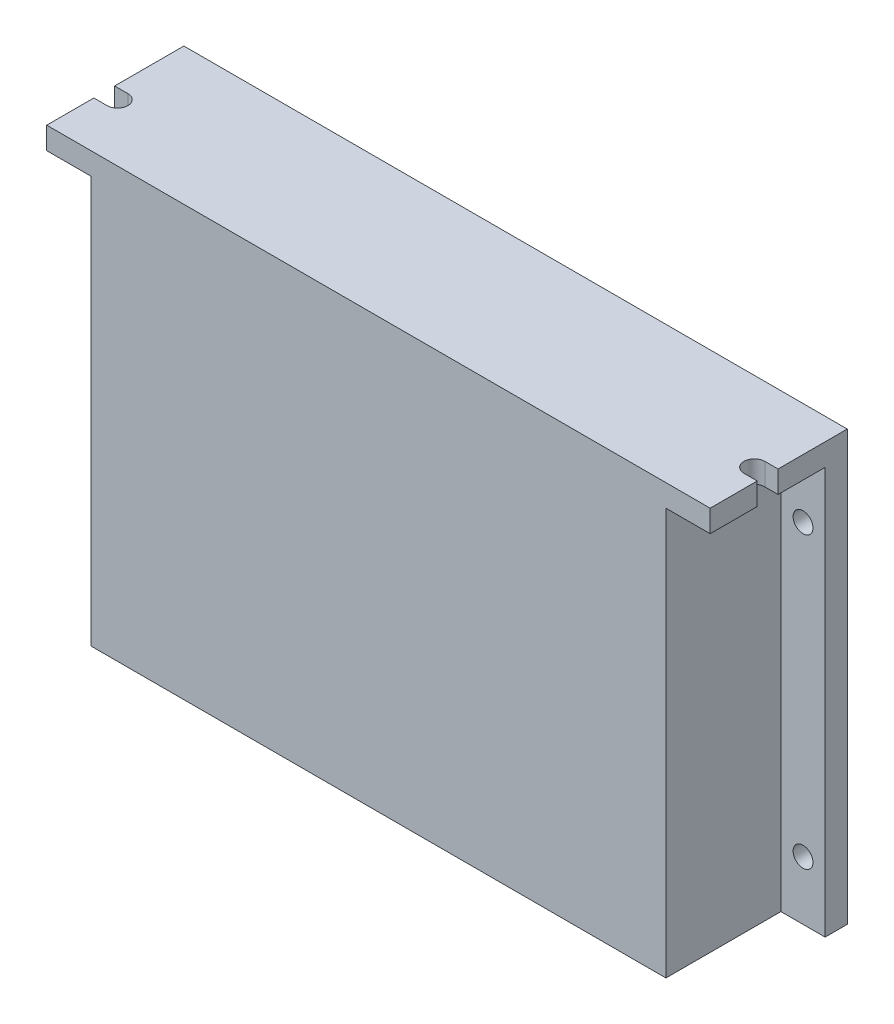
from build123d import *

# Parameters (mm, degrees)
SKETCH_1_W          = 150
SKETCH_1_H          = 31
EXTRUDE_1_DEPTH     = 97
SKETCH_2_R          = 2.25
CUT_EXTRUDE_1_DEPTH = 127.471340627
SKETCH_3_W          = 10
SKETCH_3_H          = 92
CUT_EXTRUDE_2_DEPTH = 26
CUT_EXTRUDE_3_DEPTH = 5


with BuildPart() as part:
    # 草图1 → 凸台-拉伸1 (new body)
    with BuildSketch(Plane(origin=(0, 0, 0), x_dir=(1, 0, 0), z_dir=(0, 1, 0))):
        Rectangle(SKETCH_1_W, SKETCH_1_H)
    extrude(amount=EXTRUDE_1_DEPTH)

    # 草图2 → 切除-拉伸1 (cut, through all)
    with BuildSketch(Plane.XY.offset(15.5)):
        with Locations((70, 13.25)):
            Circle(SKETCH_2_R)
        with Locations((70, 78.75)):
            Circle(SKETCH_2_R)
        with BuildLine():
            Line((-75, 15.5), (-72, 15.5))
            ThreePointArc((-72, 15.5), (-69.65, 13.15), (-72, 10.8))
            Line((-72, 10.8), (-75, 10.8))
            ThreePointArc((-75, 10.8), (-77.35, 13.15), (-75, 15.5))
        make_face()
        with BuildLine():
            Line((-75, 81.2), (-72, 81.2))
            ThreePointArc((-72, 81.2), (-69.65, 78.85), (-72, 76.5))
            Line((-72, 76.5), (-75, 76.5))
            ThreePointArc((-75, 76.5), (-77.35, 78.85), (-75, 81.2))
        make_face()
    extrude(amount=-CUT_EXTRUDE_1_DEPTH, mode=Mode.SUBTRACT)

    # 草图3 → 切除-拉伸2 (cut)
    with BuildSketch(Plane.XY.offset(15.5)):
        with Locations((-70, 46)):
            Rectangle(SKETCH_3_W, SKETCH_3_H)
    cut_extrude_2 = extrude(amount=-CUT_EXTRUDE_2_DEPTH, mode=Mode.SUBTRACT)

    # 镜向1: 切除-拉伸2 across plane
    add(cut_extrude_2.mirror(Plane(origin=(0, 0, 0), x_dir=(0, 0, 1), z_dir=(1, 0, 0))), mode=Mode.SUBTRACT)

    # 草图4 → 切除-拉伸3 (cut)
    with BuildSketch(Plane.XZ.offset(-92)):
        with BuildLine():
            Line((-75, 4.85), (-72, 4.85))
            ThreePointArc((-72, 4.85), (-69.65, 2.5), (-72, 0.15))
            Line((-72, 0.15), (-75, 0.15))
            ThreePointArc((-75, 0.15), (-77.35, 2.5), (-75, 4.85))
        make_face()
    cut_extrude_3 = extrude(amount=-CUT_EXTRUDE_3_DEPTH, mode=Mode.SUBTRACT)

    # 镜向2: 切除-拉伸3 across plane
    add(cut_extrude_3.mirror(Plane(origin=(0, 0, 0), x_dir=(0, 0, 1), z_dir=(1, 0, 0))), mode=Mode.SUBTRACT)


solid = part.part
